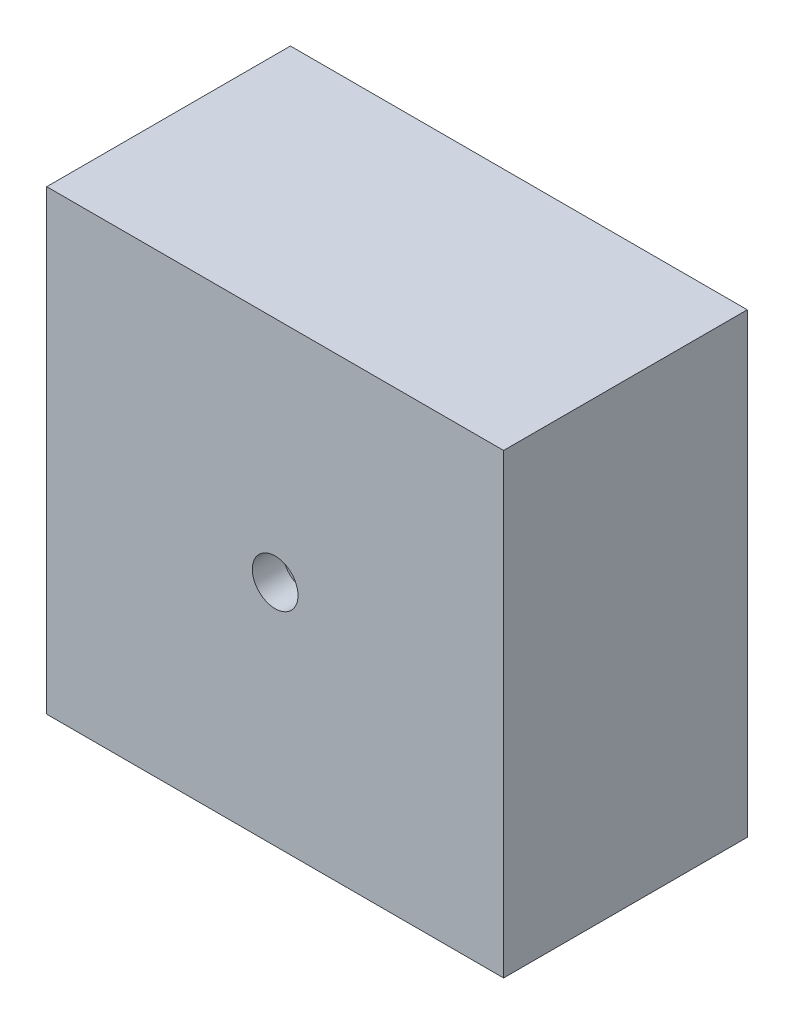
from build123d import *

# Parameters (mm, degrees)
SKETCH1_R           = 10
BOSS_EXTRUDE1_DEPTH = 5
SKETCH2_W           = 30
SKETCH2_H           = 30
SKETCH2_R           = 12
BOSS_EXTRUDE2_DEPTH = 6
SKETCH3_W           = 30
SKETCH3_H           = 30
BOSS_EXTRUDE3_DEPTH = 2
SKETCH4_R           = 1.5
CUT_EXTRUDE1_DEPTH  = 27.570660511


with BuildPart() as part:
    # Sketch1 → Boss-Extrude1 (new, symmetric)
    with BuildSketch(Plane.XY):
        Circle(SKETCH1_R)
    extrude(amount=BOSS_EXTRUDE1_DEPTH, both=True)


with BuildPart() as body_2:
    # Sketch2 → Boss-Extrude2 (new, symmetric)
    with BuildSketch(Plane.XY):
        Rectangle(SKETCH2_W, SKETCH2_H)
        Circle(SKETCH2_R, mode=Mode.SUBTRACT)
    extrude(amount=BOSS_EXTRUDE2_DEPTH, both=True)

    # Sketch3 → Boss-Extrude3 (add)
    with BuildSketch(Plane.XY.offset(6)):
        Rectangle(SKETCH3_W, SKETCH3_H)
    boss_extrude3 = extrude(amount=BOSS_EXTRUDE3_DEPTH)

    # Mirror1: Boss-Extrude3 across plane
    add(boss_extrude3.mirror(Plane.XY))

    # Sketch4 → Cut-Extrude1 (cut, through all)
    with BuildSketch(Plane.XY.offset(8)):
        Circle(SKETCH4_R)
    extrude(amount=-CUT_EXTRUDE1_DEPTH, mode=Mode.SUBTRACT)


solid = Compound([part.part, body_2.part])
